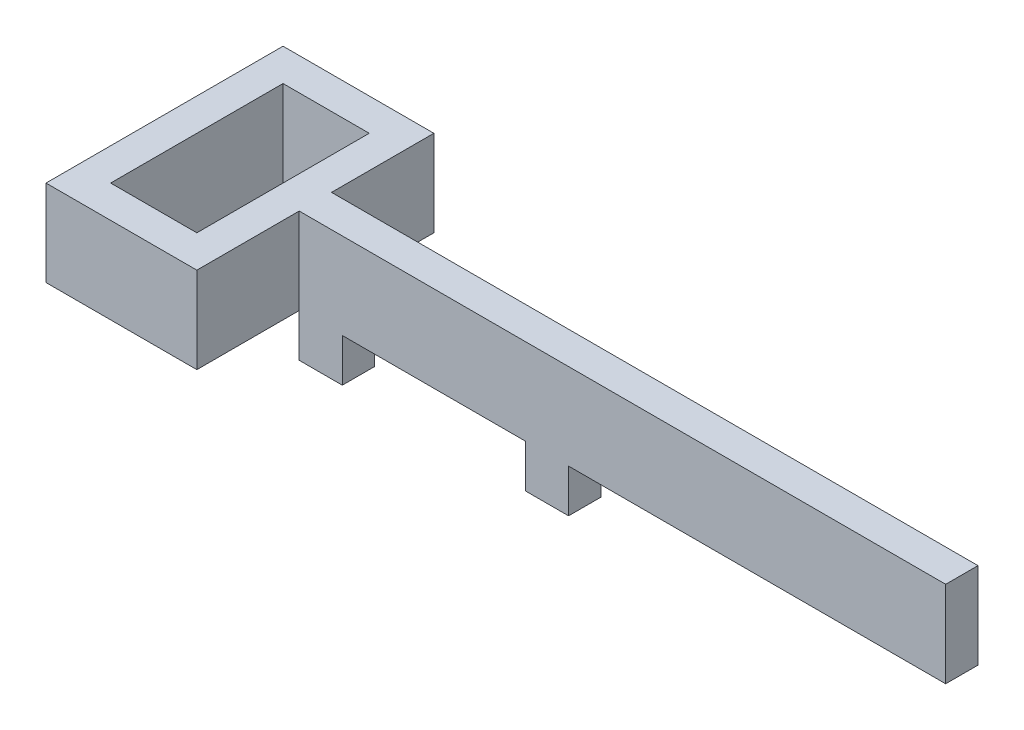
from build123d import *

# Parameters (mm, degrees)
SKETCH1_W           = 30
SKETCH1_H           = 1.5
SKETCH1_W_2         = 7
SKETCH1_H_2         = 11
SKETCH1_W_3         = 4
SKETCH1_H_3         = 8
BOSS_EXTRUDE1_DEPTH = 4
SKETCH2_W           = 2
SKETCH2_H           = 1.5
BOSS_EXTRUDE2_DEPTH = 2
SKETCH3_W           = 2
SKETCH3_H           = 1.5
BOSS_EXTRUDE3_DEPTH = 2


with BuildPart() as part:
    # Sketch1 → Boss-Extrude1 (new body)
    # profile 1 of 2: a face of its own
    with BuildSketch(Plane(origin=(0, 0, 0), x_dir=(1, 0, 0), z_dir=(0, 1, 0))):
        with Locations((18.5, 0)):
            Rectangle(SKETCH1_W, SKETCH1_H)
    # profile 2 of 2: a face of its own
    with BuildSketch(Plane(origin=(0, 0, 0), x_dir=(1, 0, 0), z_dir=(0, 1, 0))):
        Rectangle(SKETCH1_W_2, SKETCH1_H_2)
        Rectangle(SKETCH1_W_3, SKETCH1_H_3, mode=Mode.SUBTRACT)
    extrude(amount=BOSS_EXTRUDE1_DEPTH)

    # Sketch2 → Boss-Extrude2 (add)
    with BuildSketch(Plane.XZ):
        with Locations((15, 0)):
            Rectangle(SKETCH2_W, SKETCH2_H)
    extrude(amount=BOSS_EXTRUDE2_DEPTH)

    # Sketch3 → Boss-Extrude3 (add)
    with BuildSketch(Plane(origin=(0, 0, 0), x_dir=(-1, 0, 0), z_dir=(0, -1, 0))):
        with Locations((-4.5, 0)):
            Rectangle(SKETCH3_W, SKETCH3_H)
    extrude(amount=BOSS_EXTRUDE3_DEPTH)


solid = part.part
